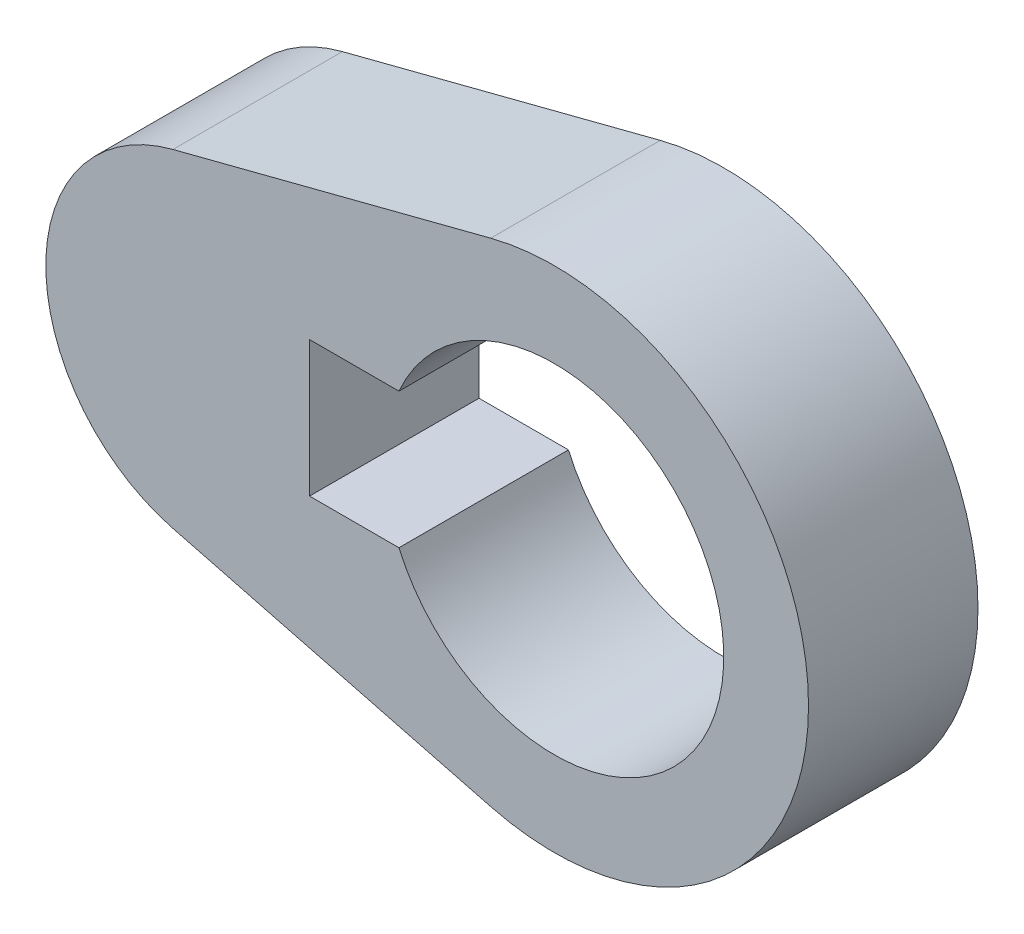
from build123d import *

# Parameters (mm, degrees)
BOSS_EXTRUDE2_DEPTH = 5


with BuildPart() as part:
    # Sketch3 → Boss-Extrude2 (new body)
    with BuildSketch(Plane.XY):
        with BuildLine():
            ThreePointArc((-18.75, 4.841229183), (-22.5, 0), (-18.75, -4.841229183))
            Line((-18.75, -4.841229183), (-9.375, -7.261843774))
            ThreePointArc((-9.375, -7.261843774), (0, 0), (-9.375, 7.261843774))
            Line((-9.375, 7.261843774), (-18.75, 4.841229183))
        make_face()
        with BuildLine():
            ThreePointArc((-12.082575695, 2), (-2.5, 0), (-12.082575695, -2))
            Line((-12.082575695, -2), (-14.72, -2))
            Line((-14.72, -2), (-14.72, 2))
            Line((-14.72, 2), (-12.082575695, 2))
        make_face(mode=Mode.SUBTRACT)
    extrude(amount=BOSS_EXTRUDE2_DEPTH)


solid = part.part
